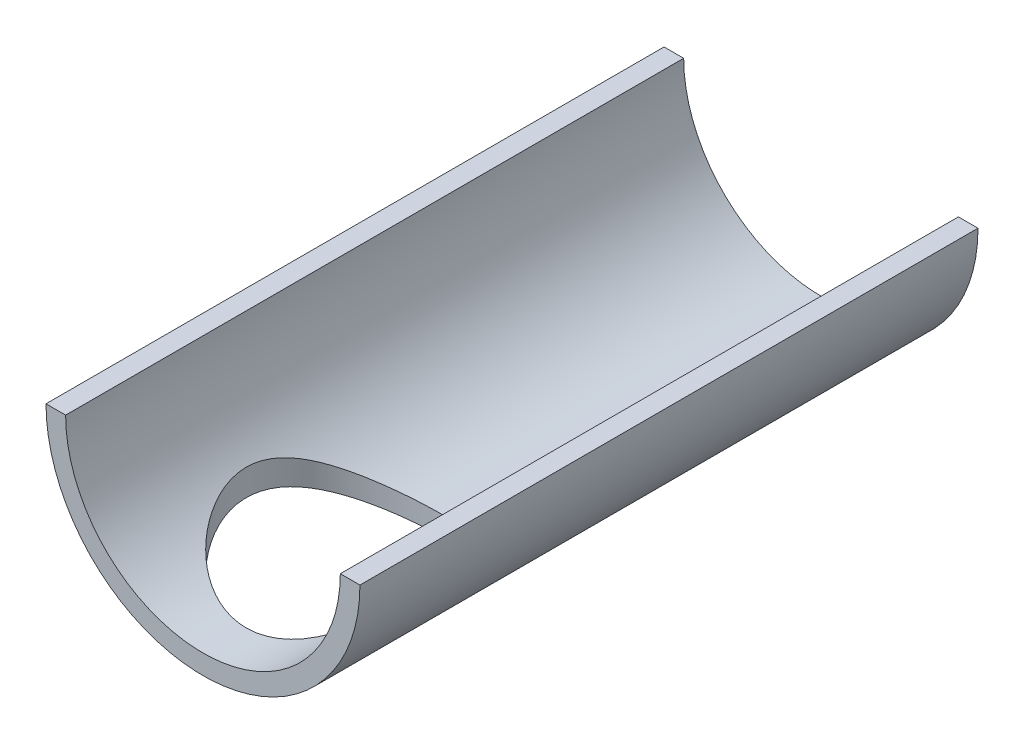
from build123d import *

# Parameters (mm, degrees)
SKETCH1_R           = 25.4
SKETCH1_R_2         = 22.225
BOSS_EXTRUDE1_DEPTH = 914.4
CUT_EXTRUDE1_START  = -100.0125
SKETCH2_R           = 25.4
CUT_EXTRUDE1_DEPTH  = 816.09278356
CUT_EXTRUDE3_DEPTH  = 107.267681617
SKETCH6_R           = 15.875
CUT_EXTRUDE5_DEPTH  = 107.267681617


with BuildPart() as part:
    # Sketch1 → Boss-Extrude1 (new body)
    with BuildSketch(Plane.XY):
        Circle(SKETCH1_R)
        Circle(SKETCH1_R_2, mode=Mode.SUBTRACT)
    extrude(amount=BOSS_EXTRUDE1_DEPTH)

    # Sketch2 → Cut-Extrude1 (cut, through all)
    with BuildSketch(Plane(origin=(0, 0, 0), x_dir=(-1, 0, 0), z_dir=(0, 0, -1)).offset(CUT_EXTRUDE1_START)):
        Circle(SKETCH2_R)
    extrude(amount=-CUT_EXTRUDE1_DEPTH, mode=Mode.SUBTRACT)

    # Sketch4 → Cut-Extrude3 (cut, through all)
    with BuildSketch(Plane.XY):
        with BuildLine():
            Line((-25.4, 0), (25.4, 0))
            ThreePointArc((25.4, 0), (0, 25.4), (-25.4, 0))
        make_face()
    extrude(amount=CUT_EXTRUDE3_DEPTH, mode=Mode.SUBTRACT)

    # Sketch6 → Cut-Extrude5 (cut, through all)
    with BuildSketch(Plane(origin=(0, 0, 0), x_dir=(1, 0, 0), z_dir=(0, 1, 0))):
        with Locations(Location((0, -77.121807345, 0), (0, 0, 270))):
            Circle(SKETCH6_R)
    extrude(amount=-CUT_EXTRUDE5_DEPTH, mode=Mode.SUBTRACT)


solid = part.part
